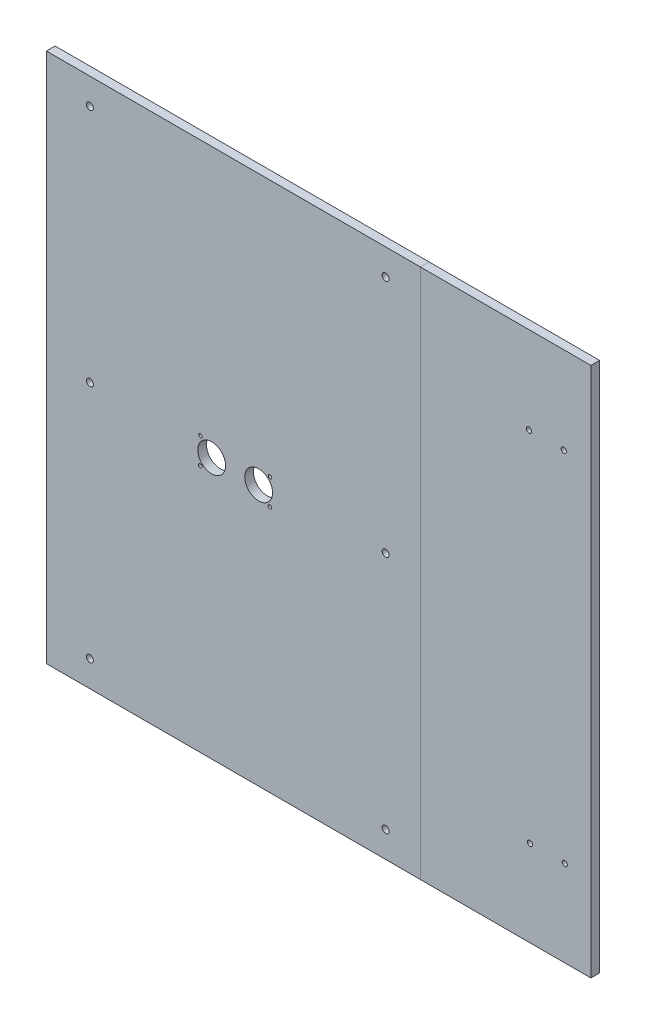
from build123d import *

# Parameters (mm, degrees)
ESQUISSE1_W             = 215
ESQUISSE1_H             = 305
BOSS_EXTRU_1_DEPTH      = 5
ESQUISSE2_R             = 2
ENL_V_MAT_EXTRU_1_DEPTH = 5
ESQUISSE3_W             = 98
ESQUISSE3_H             = 305
BOSS_EXTRU_2_DEPTH      = 5
ESQUISSE4_R             = 1.5
ENL_V_MAT_EXTRU_3_DEPTH = 438.057204494
ESQUISSE5_R             = 1.5
ENL_V_MAT_EXTRU_4_DEPTH = 438.057204494
ESQUISSE6_R             = 8
ENL_V_MAT_EXTRU_5_DEPTH = 438.057204494
ESQUISSE7_R             = 1
ENL_V_MAT_EXTRU_7_DEPTH = 438.057204494


with BuildPart() as part:
    # Esquisse1 → Boss.-Extru.1 (new body)
    with BuildSketch(Plane.XY):
        with Locations((107.5, 152.5)):
            Rectangle(ESQUISSE1_W, ESQUISSE1_H)
    extrude(amount=BOSS_EXTRU_1_DEPTH)

    # Esquisse2 → Enlèv. mat.-Extru.1 (cut)
    with BuildSketch(Plane(origin=(0, 0, 0), x_dir=(-1, 0, 0), z_dir=(0, 0, -1))):
        with Locations((-195, 290)):
            Circle(ESQUISSE2_R)
        with Locations((-25, 290)):
            Circle(ESQUISSE2_R)
        with Locations((-25, 15)):
            Circle(ESQUISSE2_R)
        with Locations((-195, 15)):
            Circle(ESQUISSE2_R)
        with Locations((-195, 152.5)):
            Circle(ESQUISSE2_R)
        with Locations((-25, 152.5)):
            Circle(ESQUISSE2_R)
    extrude(amount=-ENL_V_MAT_EXTRU_1_DEPTH, mode=Mode.SUBTRACT)

    # Esquisse6 → Enlèv. mat.-Extru.5 (cut, through all)
    with BuildSketch(Plane(origin=(0, 0, 0), x_dir=(-1, 0, 0), z_dir=(0, 0, -1))):
        with Locations((-122, 150)):
            Circle(ESQUISSE6_R)
        with Locations((-95, 150)):
            Circle(ESQUISSE6_R)
    extrude(amount=-ENL_V_MAT_EXTRU_5_DEPTH, mode=Mode.SUBTRACT)

    # Esquisse7 → Enlèv. mat.-Extru.7 (cut, through all)
    with BuildSketch(Plane(origin=(0, 0, 0), x_dir=(-1, 0, 0), z_dir=(0, 0, -1))):
        with Locations((-128.548036325, 157.285475877)):
            Circle(ESQUISSE7_R)
        with Locations((-128.451980772, 142.285475877)):
            Circle(ESQUISSE7_R)
        with Locations((-88.548036325, 157.714598257)):
            Circle(ESQUISSE7_R)
        with Locations((-88.451947576, 142.714598257)):
            Circle(ESQUISSE7_R)
    extrude(amount=-ENL_V_MAT_EXTRU_7_DEPTH, mode=Mode.SUBTRACT)


with BuildPart() as body_2:
    # Esquisse3 → Boss.-Extru.2 (new body)
    with BuildSketch(Plane(origin=(0, 0, 0), x_dir=(-1, 0, 0), z_dir=(0, 0, -1))):
        with Locations((-264, 152.5)):
            Rectangle(ESQUISSE3_W, ESQUISSE3_H)
    extrude(amount=-BOSS_EXTRU_2_DEPTH)

    # Esquisse4 → Enlèv. mat.-Extru.3 (cut, through all)
    with BuildSketch(Plane(origin=(0, 0, 0), x_dir=(-1, 0, 0), z_dir=(0, 0, -1))):
        with Locations((-277.4, 255)):
            Circle(ESQUISSE4_R)
        with Locations((-297.4, 255)):
            Circle(ESQUISSE4_R)
    extrude(amount=-ENL_V_MAT_EXTRU_3_DEPTH, mode=Mode.SUBTRACT)

    # Esquisse5 → Enlèv. mat.-Extru.4 (cut, through all)
    with BuildSketch(Plane.XY.offset(5)):
        with Locations((278, 49.5)):
            Circle(ESQUISSE5_R)
        with Locations((298, 49.5)):
            Circle(ESQUISSE5_R)
    extrude(amount=-ENL_V_MAT_EXTRU_4_DEPTH, mode=Mode.SUBTRACT)


solid = Compound([part.part, body_2.part])
